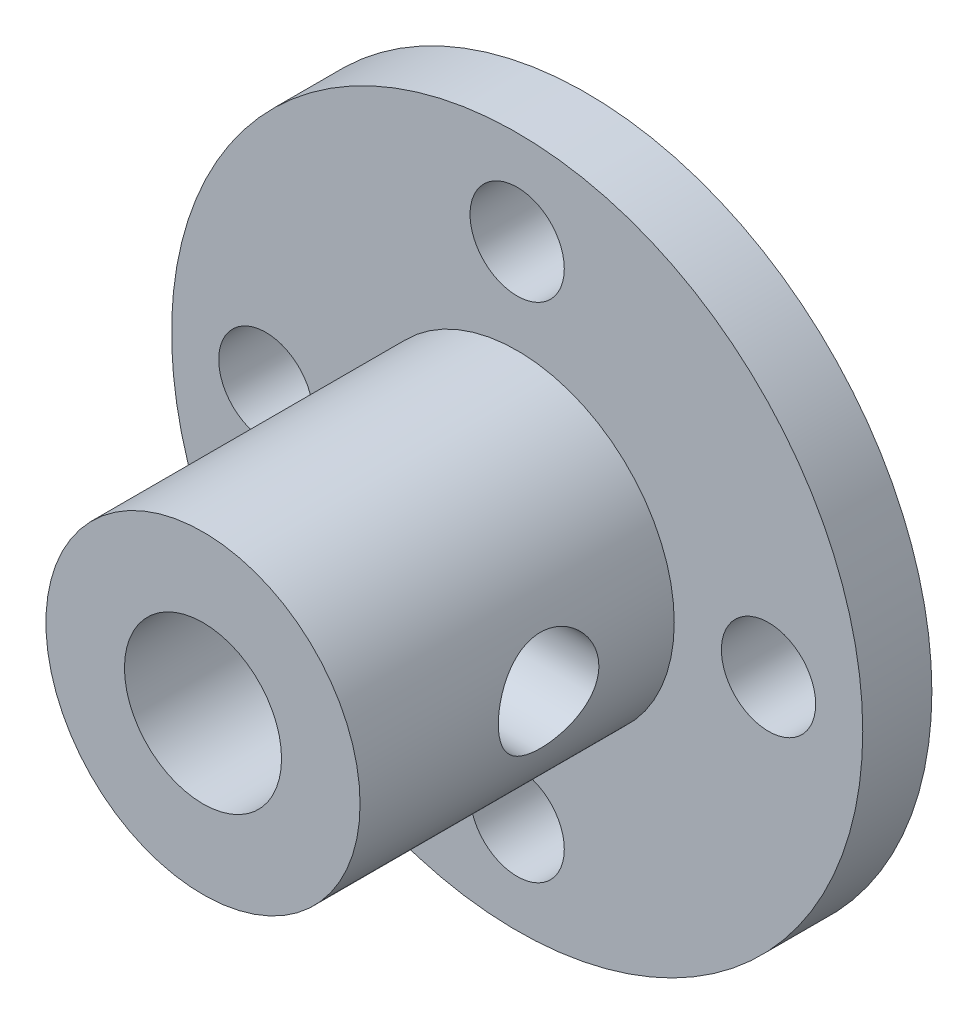
from build123d import *

# Parameters (mm, degrees)
SKETCH_1_R               = 11
EXTRUDE_1_DEPTH          = 2.2
SKETCH_2_R               = 5
EXTRUDE_2_DEPTH          = 10
SKETCH_3_R               = 1.5
CUT_EXTRUDE_1_DEPTH      = 10
CUT_EXTRUDE_2_DEPTH      = 10
CUT_EXTRUDE_2_DEPTH_BACK = 10
SKETCH_4_R               = 1.6
SKETCH_5_R               = 2.5
CUT_EXTRUDE_3_DEPTH      = 50


with BuildPart() as part:
    # 草图1 → 凸台-拉伸1 (new body)
    with BuildSketch(Plane.XY):
        Circle(SKETCH_1_R)
    extrude(amount=EXTRUDE_1_DEPTH)

    # 草图2 → 凸台-拉伸2 (add)
    with BuildSketch(Plane.XY.offset(2.2)):
        Circle(SKETCH_2_R)
    extrude(amount=EXTRUDE_2_DEPTH)

    # 草图3 → 切除-拉伸1 (cut)
    with BuildSketch(Plane.XY.offset(2.2)):
        with Locations((8, 0)):
            Circle(SKETCH_3_R)
        with Locations((0, -8)):
            Circle(SKETCH_3_R)
        with Locations((-8, 0)):
            Circle(SKETCH_3_R)
        with Locations((0, 8)):
            Circle(SKETCH_3_R)
    extrude(amount=-CUT_EXTRUDE_1_DEPTH, mode=Mode.SUBTRACT)

    # 草图4 → 切除-拉伸2 (cut, two sides: drawn at the far end of the back side and taken through both)
    with BuildSketch(Plane(origin=(0, 0, 0), x_dir=(0, 0, -1), z_dir=(1, 0, 0)).offset(-CUT_EXTRUDE_2_DEPTH_BACK)):
        with Locations((-6.2, 0)):
            Circle(SKETCH_4_R)
    extrude(amount=CUT_EXTRUDE_2_DEPTH + CUT_EXTRUDE_2_DEPTH_BACK, mode=Mode.SUBTRACT)

    # 草图5 → 切除-拉伸3 (cut)
    with BuildSketch(Plane(origin=(0, 0, 0), x_dir=(-1, 0, 0), z_dir=(0, 0, -1))):
        Circle(SKETCH_5_R)
    extrude(amount=-CUT_EXTRUDE_3_DEPTH, mode=Mode.SUBTRACT)


solid = part.part
